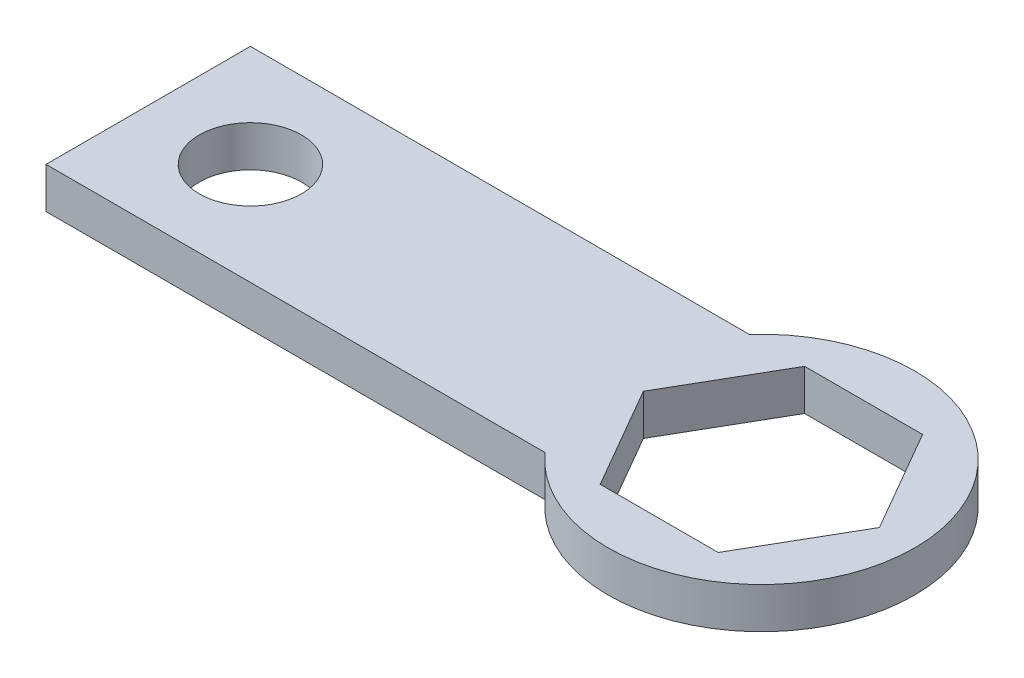
from build123d import *

# Parameters (mm, degrees)
SKETCH1_R           = 1.5875
BOSS_EXTRUDE1_DEPTH = 1.27
CUT_EXTRUDE1_DEPTH  = 2.54


with BuildPart() as part:
    # Sketch1 → Boss-Extrude1 (new body)
    with BuildSketch(Plane(origin=(0, 0, 0), x_dir=(1, 0, 0), z_dir=(0, 1, 0))):
        with BuildLine():
            Line((-3.549757914, 3.175), (-19.05, 3.175))
            Line((-19.05, 3.175), (-19.05, -3.175))
            Line((-19.05, -3.175), (-3.549757914, -3.175))
            ThreePointArc((-3.549757914, -3.175), (4.7625, 0), (-3.549757914, 3.175))
        make_face()
        with Locations((-15.875, 0)):
            Circle(SKETCH1_R, mode=Mode.SUBTRACT)
    extrude(amount=BOSS_EXTRUDE1_DEPTH)

    # Sketch2 → Cut-Extrude1 (cut)
    with BuildSketch(Plane(origin=(0, 1.27, 0), x_dir=(1, 0, 0), z_dir=(0, 1, 0))):
        Polygon((3.666174209, 0), (1.833087105, 3.175), (-1.833087105, 3.175), (-3.666174209, 0), (-1.833087105, -3.175), (1.833087105, -3.175), align=None)
    extrude(amount=-CUT_EXTRUDE1_DEPTH, mode=Mode.SUBTRACT)


solid = part.part
